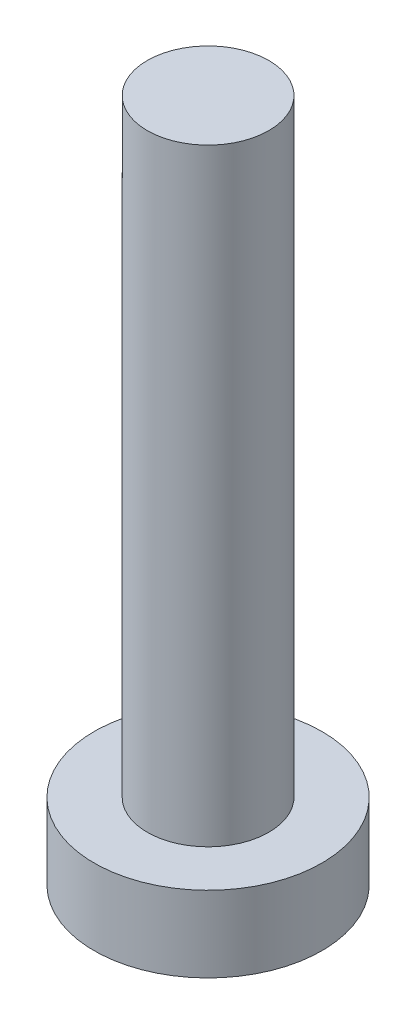
from build123d import *

# Parameters (mm, degrees)
SKETCH_1_R      = 4
EXTRUDE_1_DEPTH = 40
SKETCH_2_R      = 7.5
EXTRUDE_2_DEPTH = 5


with BuildPart() as part:
    # 草圖1 → 填料-伸長1 (new body)
    with BuildSketch(Plane(origin=(0, 0, 0), x_dir=(1, 0, 0), z_dir=(0, 1, 0))):
        with Locations(Location((0, 0, 0), (0, 0, 270))):
            Circle(SKETCH_1_R)
    extrude(amount=EXTRUDE_1_DEPTH)

    # 草圖2 → 填料-伸長2 (add)
    with BuildSketch(Plane(origin=(0, 0, 0), x_dir=(-1, 0, 0), z_dir=(0, -1, 0))):
        with Locations(Location((0, 0, 0), (0, 0, 90))):
            Circle(SKETCH_2_R)
    extrude(amount=EXTRUDE_2_DEPTH)


solid = part.part
